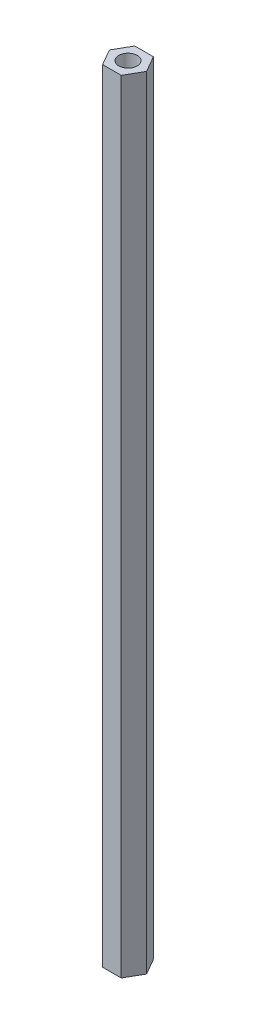
from build123d import *

# Parameters (mm, degrees)
SKETCH1_R           = 2
BOSS_EXTRUDE1_DEPTH = 170


with BuildPart() as part:
    # Sketch1 → Boss-Extrude1 (new body)
    with BuildSketch(Plane(origin=(0, 0, 0), x_dir=(1, 0, 0), z_dir=(0, 1, 0))):
        Polygon((4.041451884, 0), (2.020725942, 3.5), (-2.020725942, 3.5), (-4.041451884, 0), (-2.020725942, -3.5), (2.020725942, -3.5), align=None)
        with Locations(Location((0, 0, 0), (0, 0, 270))):
            Circle(SKETCH1_R, mode=Mode.SUBTRACT)
    extrude(amount=BOSS_EXTRUDE1_DEPTH)


solid = part.part
